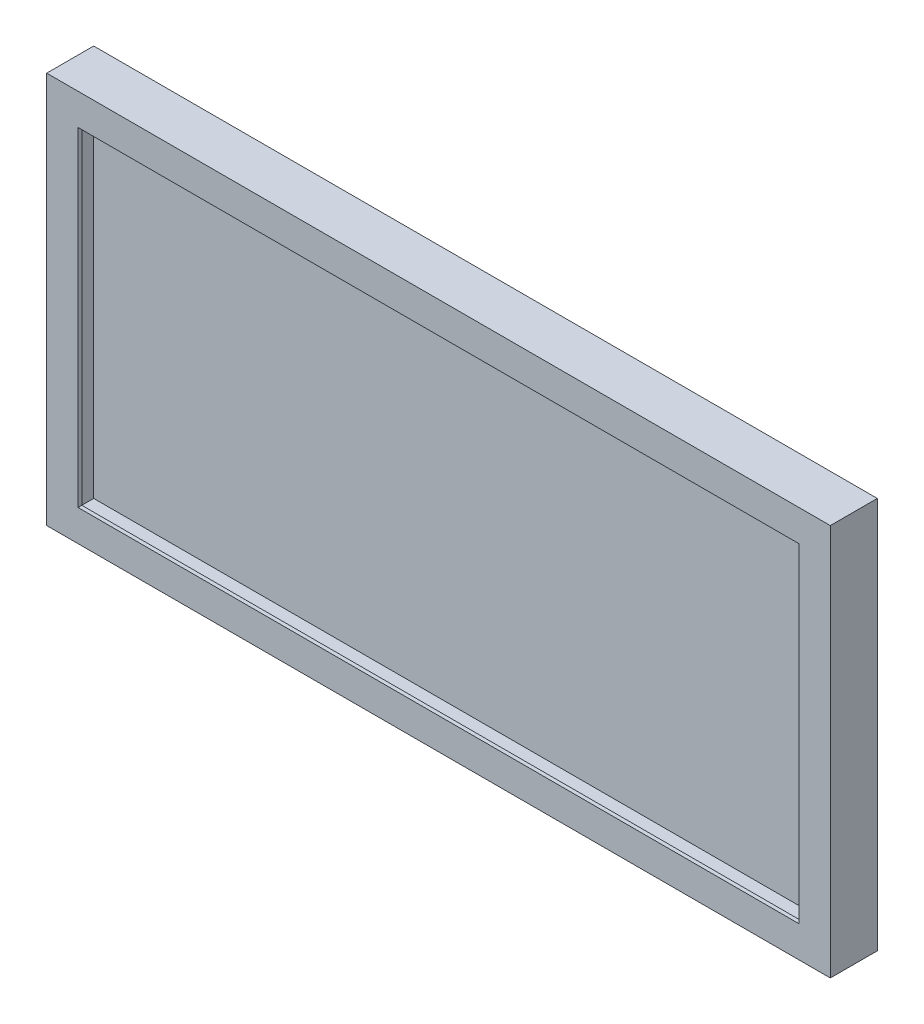
from build123d import *

# Parameters (mm, degrees)
SKETCH_1_W          = 250
SKETCH_1_H          = 125
EXTRUDE_1_DEPTH     = 15
SHELL_1_T           = 1.2
CUT_EXTRUDE_1_REACH = 142.557
SKETCH_3_W          = 230
SKETCH_3_H          = 105


with BuildPart() as part:
    # 草图1 → 凸台-拉伸1 (new body)
    with BuildSketch(Plane.XY):
        Rectangle(SKETCH_1_W, SKETCH_1_H)
    extrude(amount=EXTRUDE_1_DEPTH)

    # 抽壳1 (no face opened: a closed hollow body)
    add(offset(amount=-SHELL_1_T, mode=Mode.PRIVATE), mode=Mode.SUBTRACT)

    # 草图3 → 切除-拉伸1 (cut, up to next)
    with BuildSketch(Plane.XY.offset(15), mode=Mode.PRIVATE) as cut_extrude_1_sk1:
        Rectangle(SKETCH_3_W, SKETCH_3_H)
    cut_extrude_1_tool1 = extrude(cut_extrude_1_sk1.sketch, amount=-CUT_EXTRUDE_1_REACH, mode=Mode.PRIVATE) & part.part
    add(cut_extrude_1_tool1.solids().sort_by_distance((0, 0, 15))[0], mode=Mode.SUBTRACT)


solid = part.part
